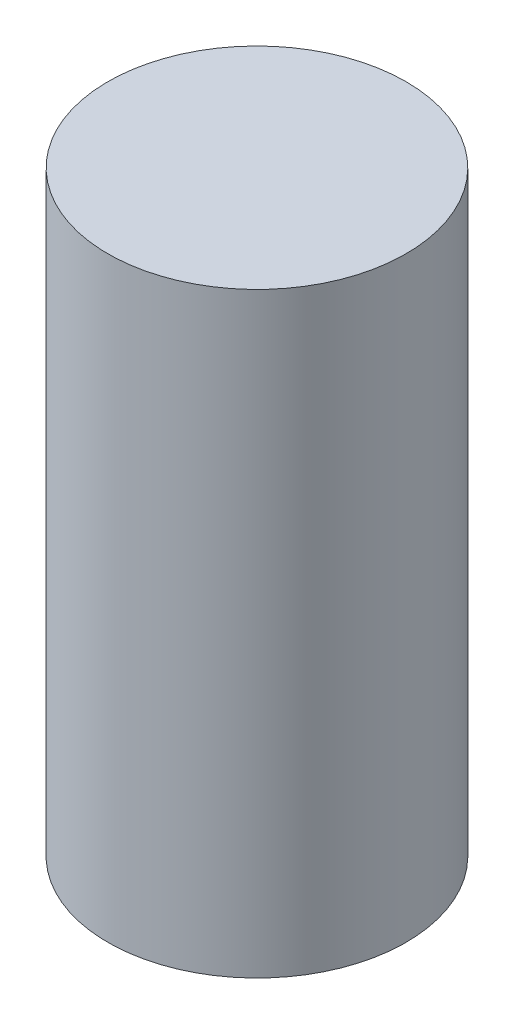
from build123d import *

# Parameters (mm, degrees)
SKETCH1_R           = 4.7625
BOSS_EXTRUDE1_DEPTH = 19.05


with BuildPart() as part:
    # Sketch1 → Boss-Extrude1 (new body)
    with BuildSketch(Plane(origin=(0, 0, 0), x_dir=(1, 0, 0), z_dir=(0, 1, 0))):
        with Locations(Location((0, 0, 0), (0, 0, 90))):
            Circle(SKETCH1_R)
    extrude(amount=BOSS_EXTRUDE1_DEPTH)


solid = part.part
